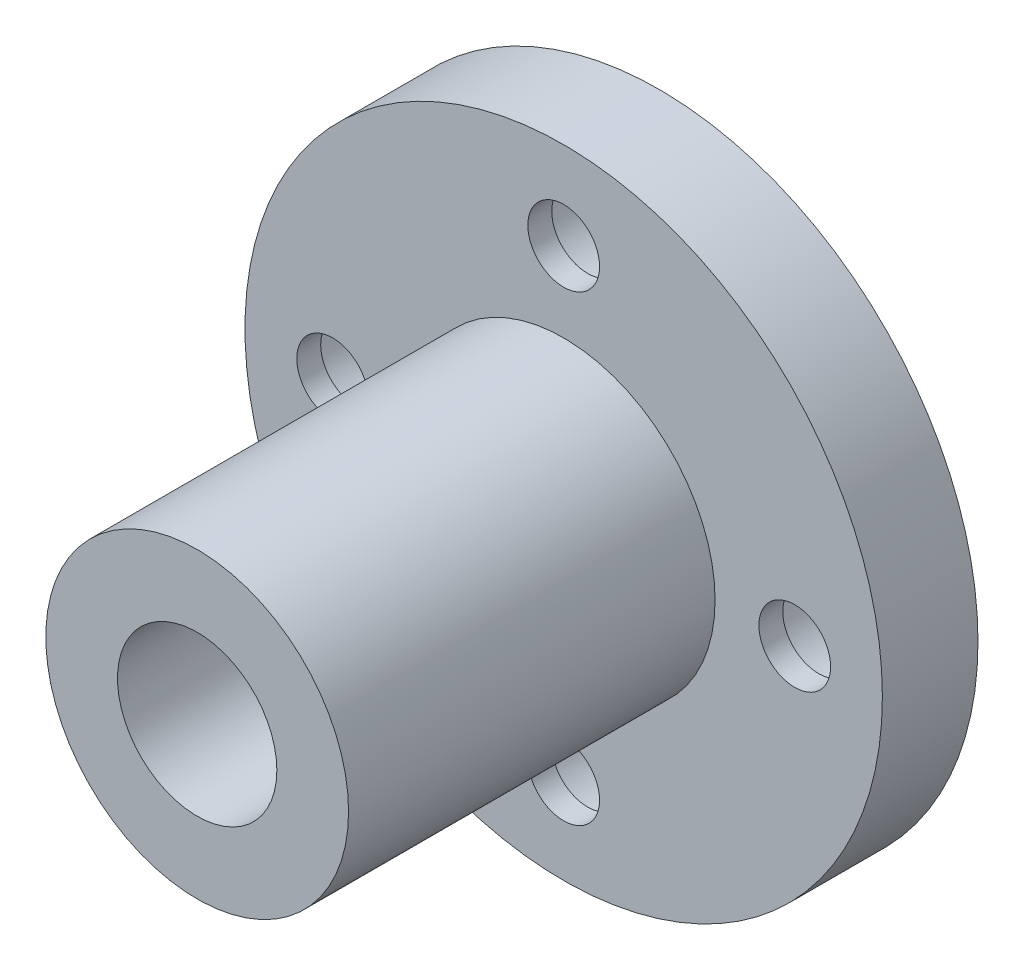
from build123d import *

# Parameters (mm, degrees)
SKETCH_1_R          = 20
SKETCH_1_R_2        = 5
SKETCH_1_R_3        = 2.25
EXTRUDE_1_DEPTH     = 6
SKETCH_2_R          = 9.5
SKETCH_2_R_2        = 5
EXTRUDE_2_DEPTH     = 23
SKETCH_3_R          = 3.75
CUT_EXTRUDE_1_DEPTH = 4.5


with BuildPart() as part:
    # Эскиз1 → Бобышка-Вытянуть1 (new body)
    with BuildSketch(Plane.XY):
        Circle(SKETCH_1_R)
        Circle(SKETCH_1_R_2, mode=Mode.SUBTRACT)
        with Locations((0, 14.5)):
            Circle(SKETCH_1_R_3, mode=Mode.SUBTRACT)
        with Locations((14.5, 0)):
            Circle(SKETCH_1_R_3, mode=Mode.SUBTRACT)
        with Locations((0, -14.5)):
            Circle(SKETCH_1_R_3, mode=Mode.SUBTRACT)
        with Locations((-14.5, 0)):
            Circle(SKETCH_1_R_3, mode=Mode.SUBTRACT)
    extrude(amount=EXTRUDE_1_DEPTH)

    # Эскиз2 → Бобышка-Вытянуть2 (add)
    with BuildSketch(Plane.XY.offset(6)):
        Circle(SKETCH_2_R)
        Circle(SKETCH_2_R_2, mode=Mode.SUBTRACT)
    extrude(amount=EXTRUDE_2_DEPTH)

    # Эскиз3 → Вырез-Вытянуть1 (cut)
    with BuildSketch(Plane(origin=(0, 0, 0), x_dir=(-1, 0, 0), z_dir=(0, 0, -1))):
        with Locations((0, 14.5)):
            Circle(SKETCH_3_R)
        with Locations((14.5, 0)):
            Circle(SKETCH_3_R)
        with Locations((0, -14.5)):
            Circle(SKETCH_3_R)
        with Locations((-14.5, 0)):
            Circle(SKETCH_3_R)
    extrude(amount=-CUT_EXTRUDE_1_DEPTH, mode=Mode.SUBTRACT)


solid = part.part
